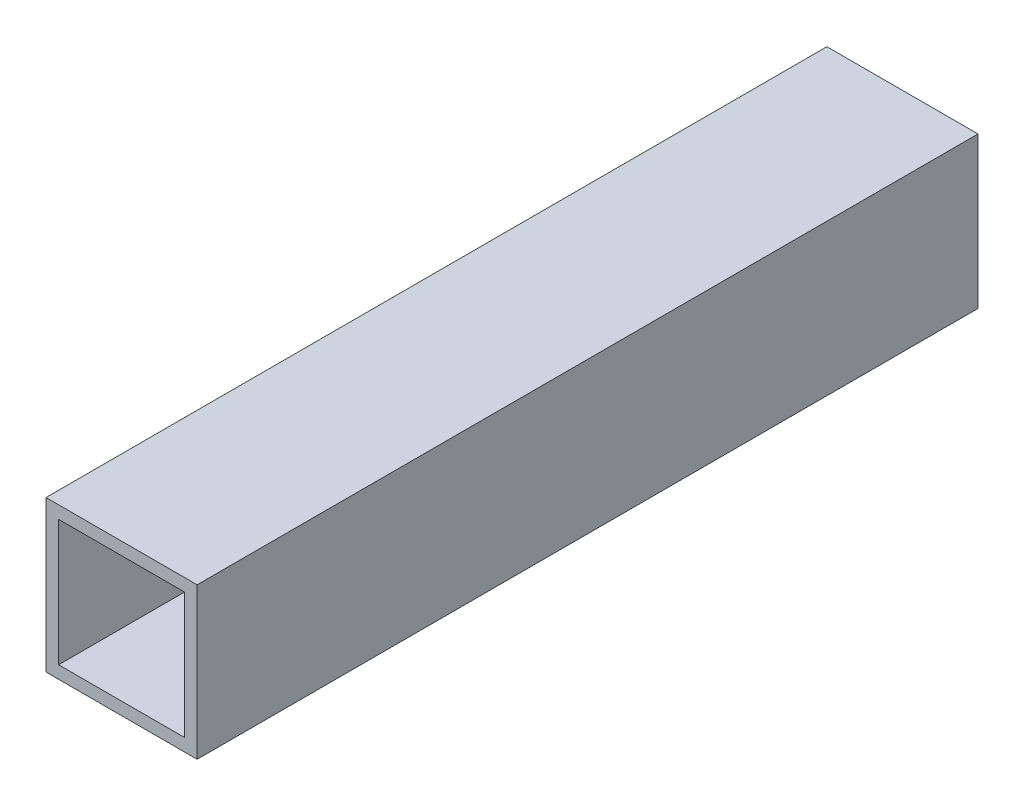
from build123d import *

# Parameters (mm, degrees)
SKETCH_1_W      = 24
SKETCH_1_H      = 24
SKETCH_1_W_2    = 20
SKETCH_1_H_2    = 20
EXTRUDE_1_DEPTH = 62


with BuildPart() as part:
    # 草图1 → 凸台-拉伸1 (new, symmetric)
    with BuildSketch(Plane.XY):
        Rectangle(SKETCH_1_W, SKETCH_1_H)
        Rectangle(SKETCH_1_W_2, SKETCH_1_H_2, mode=Mode.SUBTRACT)
    extrude(amount=EXTRUDE_1_DEPTH, both=True)


solid = part.part
